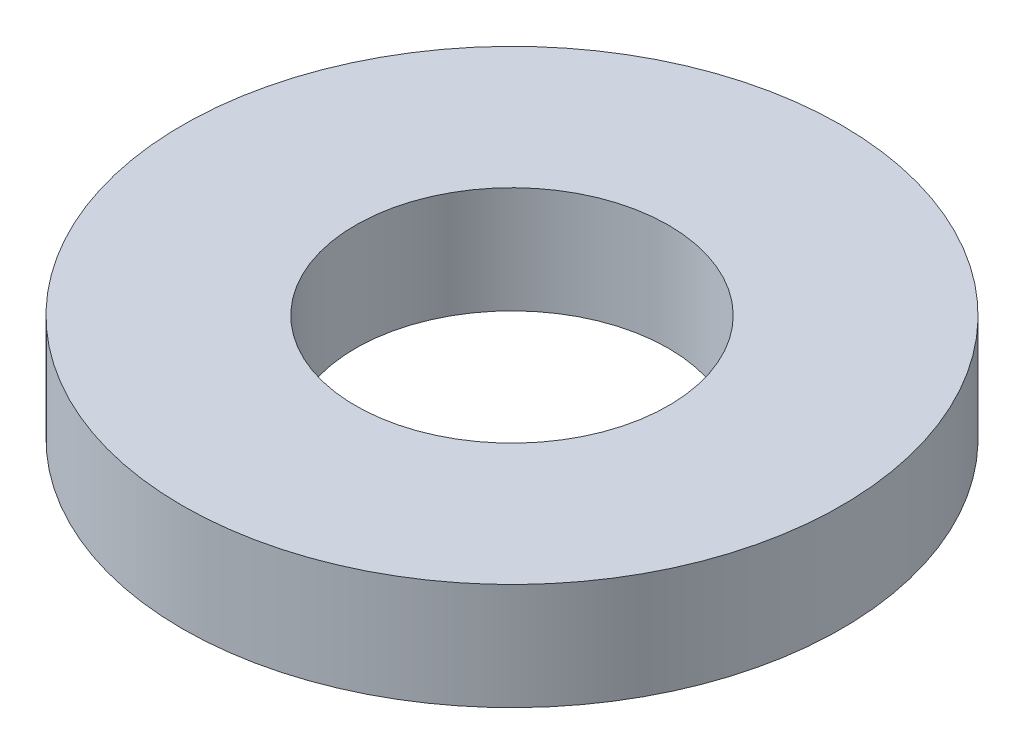
from build123d import *

# Parameters (mm, degrees)
SKETCH1_R           = 12.36
BOSS_EXTRUDE1_DEPTH = 4
SKETCH2_R           = 5.8674
CUT_EXTRUDE1_DEPTH  = 18.931514158


with BuildPart() as part:
    # Sketch1 → Boss-Extrude1 (new body)
    with BuildSketch(Plane(origin=(0, 0, 0), x_dir=(1, 0, 0), z_dir=(0, 1, 0))):
        with Locations(Location((0, 0, 0), (0, 0, 270))):
            Circle(SKETCH1_R)
    extrude(amount=BOSS_EXTRUDE1_DEPTH)

    # Sketch2 → Cut-Extrude1 (cut, through all)
    with BuildSketch(Plane(origin=(0, 0, 0), x_dir=(-1, 0, 0), z_dir=(0, -1, 0))):
        with Locations(Location((0, 0, 0), (0, 0, 90))):
            Circle(SKETCH2_R)
    extrude(amount=-CUT_EXTRUDE1_DEPTH, mode=Mode.SUBTRACT)


solid = part.part
